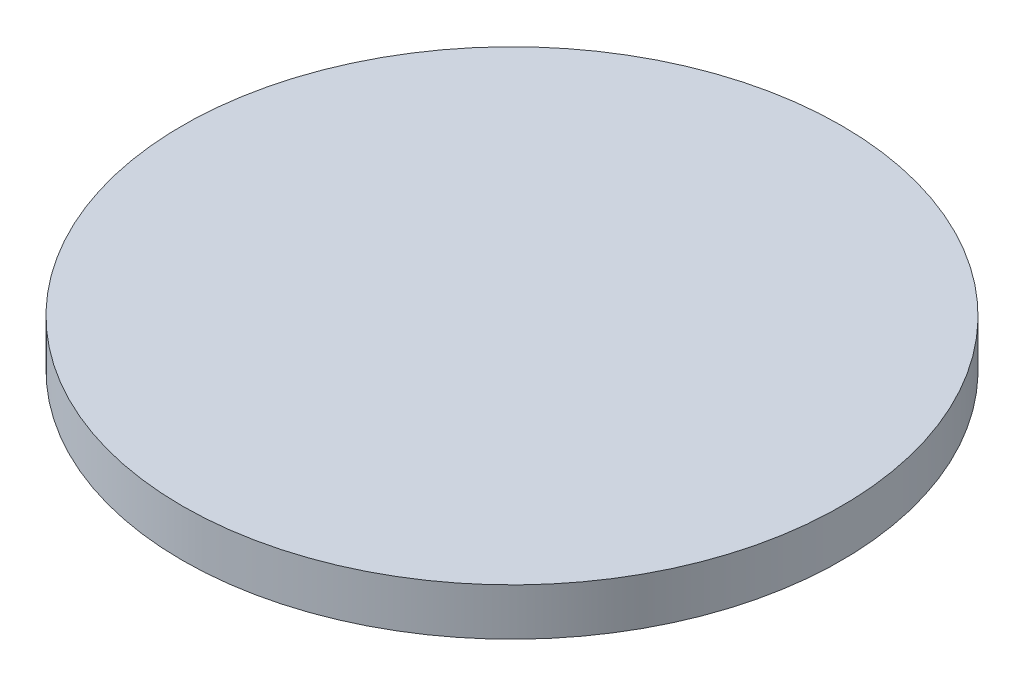
from build123d import *

# Parameters (mm, degrees)
SZKIC1_R                    = 140
DODANIE_WYCI_GNI_CIE1_DEPTH = 20


with BuildPart() as part:
    # Szkic1 → Dodanie-wyciągnięcie1 (new body)
    with BuildSketch(Plane(origin=(0, 0, 0), x_dir=(1, 0, 0), z_dir=(0, 1, 0))):
        with Locations(Location((0, 0, 0), (0, 0, 270))):
            Circle(SZKIC1_R)
    extrude(amount=DODANIE_WYCI_GNI_CIE1_DEPTH)


solid = part.part
